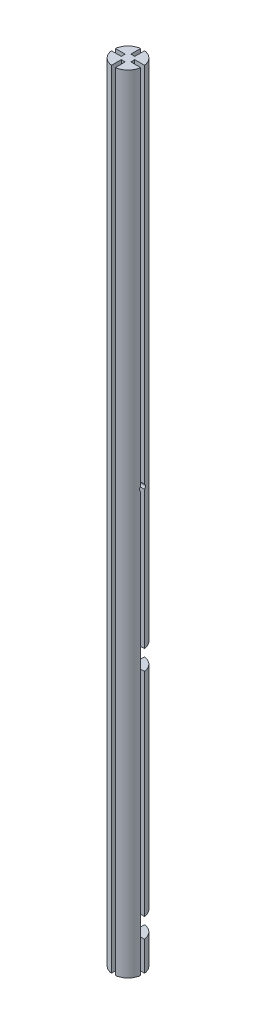
from build123d import *

# Parameters (mm, degrees)
BOSS_EXTRUDE2_DEPTH = 4000
CUT_EXTRUDE1_START  = 200
SKETCH2_W           = 74.330343737
SKETCH2_H           = 74.330343737
CUT_EXTRUDE1_DEPTH  = 50
CUT_EXTRUDE2_START  = 1380
SKETCH2_2_W         = 74.330343737
SKETCH2_2_H         = 74.330343737
CUT_EXTRUDE2_DEPTH  = 50
SKETCH3_R           = 15
CUT_EXTRUDE3_DEPTH  = 50


with BuildPart() as part:
    # Sketch1 → Boss-Extrude2 (new body)
    with BuildSketch(Plane(origin=(0, 0, 0), x_dir=(1, 0, 0), z_dir=(0, 1, 0))):
        with BuildLine():
            Line((-10, 74.330343737), (-10, 24.330343737))
            Line((-10, 24.330343737), (10, 24.330343737))
            Line((10, 24.330343737), (10, 74.330343737))
            ThreePointArc((10, 74.330343737), (53.033008589, 53.033008589), (74.330343737, 10))
            Line((74.330343737, 10), (24.330343737, 10))
            Line((24.330343737, 10), (24.330343737, -10))
            Line((24.330343737, -10), (74.330343737, -10))
            ThreePointArc((74.330343737, -10), (53.033008589, -53.033008589), (10, -74.330343737))
            Line((10, -74.330343737), (10, -24.330343737))
            Line((10, -24.330343737), (-10, -24.330343737))
            Line((-10, -24.330343737), (-10, -74.330343737))
            ThreePointArc((-10, -74.330343737), (-53.033008589, -53.033008589), (-74.330343737, -10))
            Line((-74.330343737, -10), (-24.330343737, -10))
            Line((-24.330343737, -10), (-24.330343737, 10))
            Line((-24.330343737, 10), (-74.330343737, 10))
            ThreePointArc((-74.330343737, 10), (-53.033008589, 53.033008589), (-10, 74.330343737))
        make_face()
    extrude(amount=BOSS_EXTRUDE2_DEPTH)

    # Sketch2 → Cut-Extrude1 (cut, symmetric)
    with BuildSketch(Plane(origin=(0, 0, 0), x_dir=(1, 0, 0), z_dir=(0, 1, 0)).offset(CUT_EXTRUDE1_START)):
        with Locations((37.165171869, 37.165171869)):
            Rectangle(SKETCH2_W, SKETCH2_H)
    extrude(amount=CUT_EXTRUDE1_DEPTH, both=True, mode=Mode.SUBTRACT)

    # Sketch2<2> → Cut-Extrude2 (cut, symmetric)
    with BuildSketch(Plane(origin=(0, 0, 0), x_dir=(1, 0, 0), z_dir=(0, 1, 0)).offset(CUT_EXTRUDE2_START)):
        with Locations((37.165171869, 37.165171869)):
            Rectangle(SKETCH2_2_W, SKETCH2_2_H)
    extrude(amount=CUT_EXTRUDE2_DEPTH, both=True, mode=Mode.SUBTRACT)

    # Sketch3 → Cut-Extrude3 (cut)
    with BuildSketch(Plane(origin=(74.330343737, 0, 0), x_dir=(0, 0, -1), z_dir=(1, 0, 0))):
        with Locations((0, 2143)):
            Circle(SKETCH3_R)
    extrude(amount=-CUT_EXTRUDE3_DEPTH, mode=Mode.SUBTRACT)


solid = part.part
